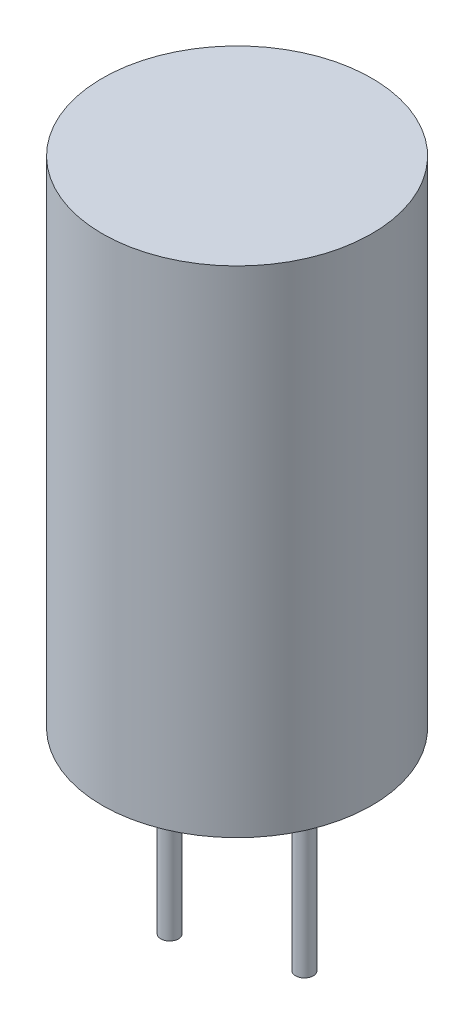
from build123d import *

# Parameters (mm, degrees)
SKETCH_1_R      = 7.62
EXTRUDE_1_DEPTH = 28
SKETCH_2_R      = 0.5
EXTRUDE_2_DEPTH = 12
SKETCH_3_R      = 0.5
EXTRUDE_3_DEPTH = 10


with BuildPart() as part:
    # 草图1 → 拉伸1 (new body)
    with BuildSketch(Plane(origin=(0, 0, 0), x_dir=(1, 0, 0), z_dir=(0, 1, 0))):
        with Locations(Location((0, 0, 0), (0, 0, 270))):
            Circle(SKETCH_1_R)
    extrude(amount=EXTRUDE_1_DEPTH)

    # 草图2 → 拉伸2 (add)
    with BuildSketch(Plane.XZ):
        with Locations(Location((-3.81, 0, 0), (0, 0, 90))):
            Circle(SKETCH_2_R)
    extrude(amount=EXTRUDE_2_DEPTH)

    # 草图3 → 拉伸3 (add)
    with BuildSketch(Plane.XZ):
        with Locations(Location((3.81, 0, 0), (0, 0, 90))):
            Circle(SKETCH_3_R)
    extrude(amount=EXTRUDE_3_DEPTH)


solid = part.part
